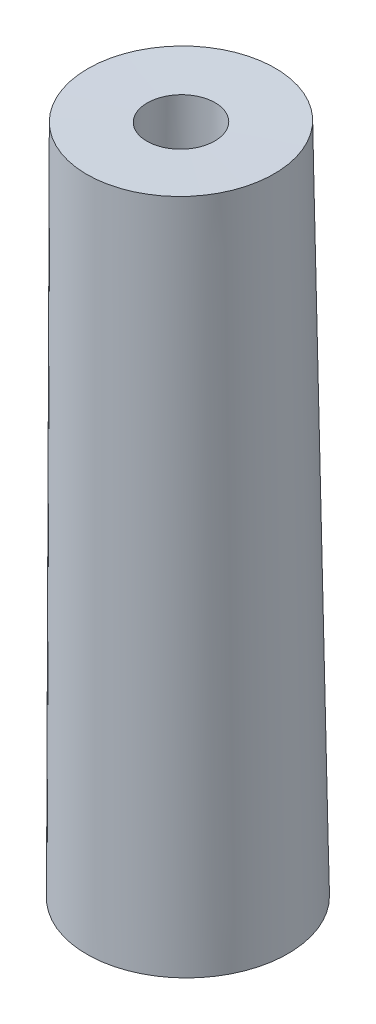
from build123d import *

# Parameters (mm, degrees)
SKETCH1_W = 10
SKETCH1_H = 112.58511474


with BuildPart() as part:
    # Sketch1 → Revolve-Thin1 (revolve)
    with BuildSketch(Plane.XY):
        with Locations((-5, -6.639634972)):
            Rectangle(SKETCH1_W, SKETCH1_H)
    revolve(axis=Axis((5.686972233, 49.652922398, 0), (0.010399100422119521, -0.9999459278933089, 0)))


solid = part.part
